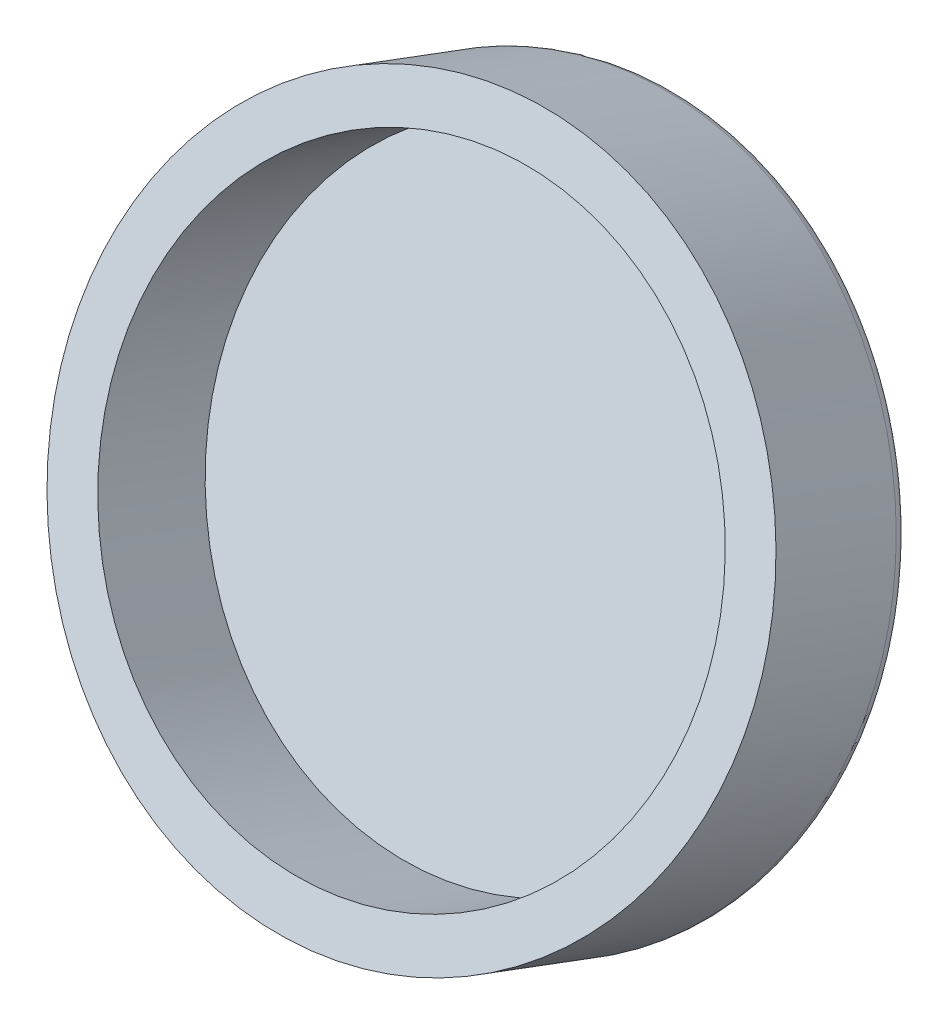
from build123d import *


with BuildPart() as part:
    # Esquisse1 → Révolution1 (revolve)
    with BuildSketch(Plane(origin=(0, -1.422218517, 0.591043356), x_dir=(1, 0, 0), z_dir=(0, -0.923433296037534, 0.3837589709300047)), mode=Mode.PRIVATE) as r_volution1_sk:
        with BuildLine():
            Line((-3.551107588, 74.919359713), (-20.518381419, 75.973693025))
            Line((-20.518381419, 75.973693025), (-20.636218671, 74.077350656))
            Line((-20.636218671, 74.077350656), (-2.070548178, 72.923694208))
            ThreePointArc((-2.070548178, 72.923694208), (-1.256749054, 73.104680894), (-0.86290701, 73.839469055))
            Line((-0.86290701, 73.839469055), (-0.335052517, 82.334175273))
            Line((-0.335052517, 82.334175273), (-3.079758578, 82.504729191))
            Line((-3.079758578, 82.504729191), (-3.551107588, 74.919359713))
        make_face()
    revolve(r_volution1_sk.sketch.rotate(Axis((-20.035513574, 30.715459255, 77.923441971), (-0.06201960656726773, -0.38302020852975566, -0.9216556234619653)), 270), axis=Axis((-20.035513574, 30.715459255, 77.923441971), (-0.06201960656726773, -0.38302020852975566, -0.9216556234619653)))


solid = part.part
